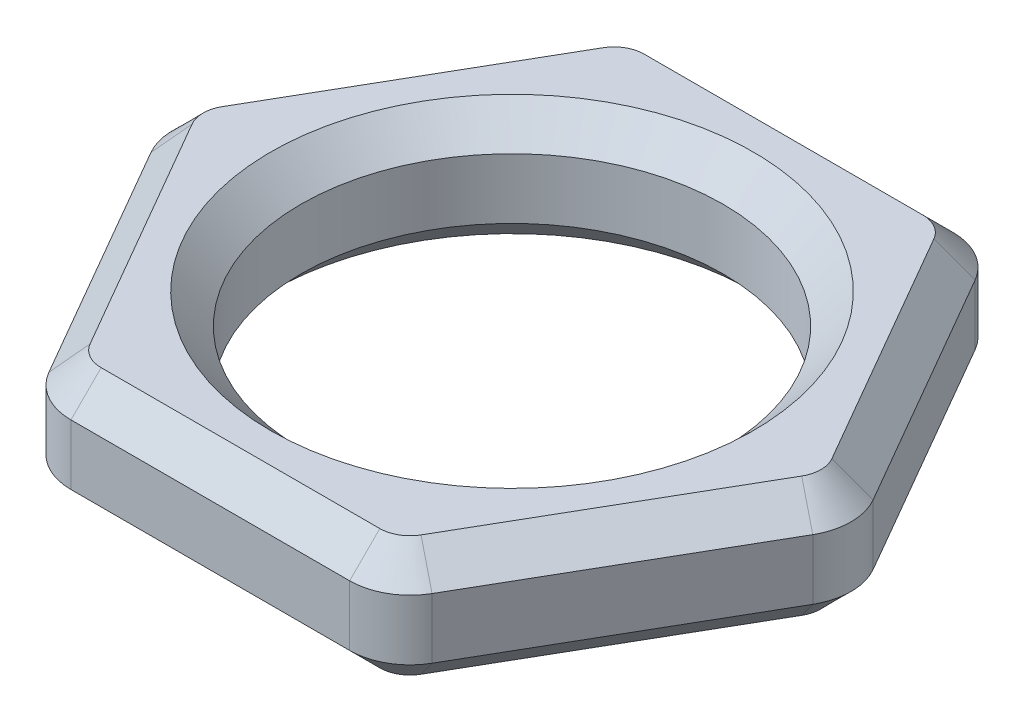
from build123d import *

# Parameters (mm, degrees)
SKETCH_1_R      = 3.5
EXTRUDE_1_DEPTH = 2
FILLET_1_R      = 1
CHAMFER_1_SIZE  = 0.5


with BuildPart() as part:
    # 草图1 → 凸台-拉伸1 (new body)
    with BuildSketch(Plane(origin=(0, 0, 0), x_dir=(1, 0, 0), z_dir=(0, 1, 0))):
        Polygon((5.773502692, 0), (2.886751346, 5), (-2.886751346, 5), (-5.773502692, 0), (-2.886751346, -5), (2.886751346, -5), align=None)
        with Locations(Location((0, 0, 0), (0, 0, 270))):
            Circle(SKETCH_1_R, mode=Mode.SUBTRACT)
    extrude(amount=EXTRUDE_1_DEPTH)

    # 圆角1
    fillet_1_edges = [part.edges().sort_by_distance(p)[0] for p in [
        (2.886751346, 1, 5),
        (-2.886751346, 1, 5),
        (-5.773502692, 1, 0),
        (-2.886751346, 1, -5),
        (2.886751346, 1, -5),
        (5.773502692, 1, 0),
    ]]
    fillet(fillet_1_edges, radius=FILLET_1_R)

    # 倒角1
    chamfer_1_edges = [part.edges().sort_by_distance(p)[0] for p in [
        (0, 0, -3.5),
        (0, 2, -3.5),
        (-4.330127019, 0, 2.5),
        (-4.330127019, 2, 2.5),
        (4.330127019, 0, 2.5),
        (0, 0, 5),
        (-4.330127019, 0, -2.5),
        (0, 0, -5),
        (4.330127019, 0, -2.5),
        (-2.809401077, 0, 4.866025404),
        (2.809401077, 0, 4.866025404),
        (5.618802154, 0, 0),
        (2.809401077, 0, -4.866025404),
        (-2.809401077, 0, -4.866025404),
        (-5.618802154, 0, 0),
        (-4.330127019, 2, -2.5),
        (4.330127019, 2, 2.5),
        (4.330127019, 2, -2.5),
        (0, 2, -5),
        (0, 2, 5),
        (-2.809401077, 2, 4.866025404),
        (2.809401077, 2, 4.866025404),
        (5.618802154, 2, 0),
        (2.809401077, 2, -4.866025404),
        (-2.809401077, 2, -4.866025404),
        (-5.618802154, 2, 0),
    ]]
    chamfer(chamfer_1_edges, length=CHAMFER_1_SIZE)


solid = part.part
